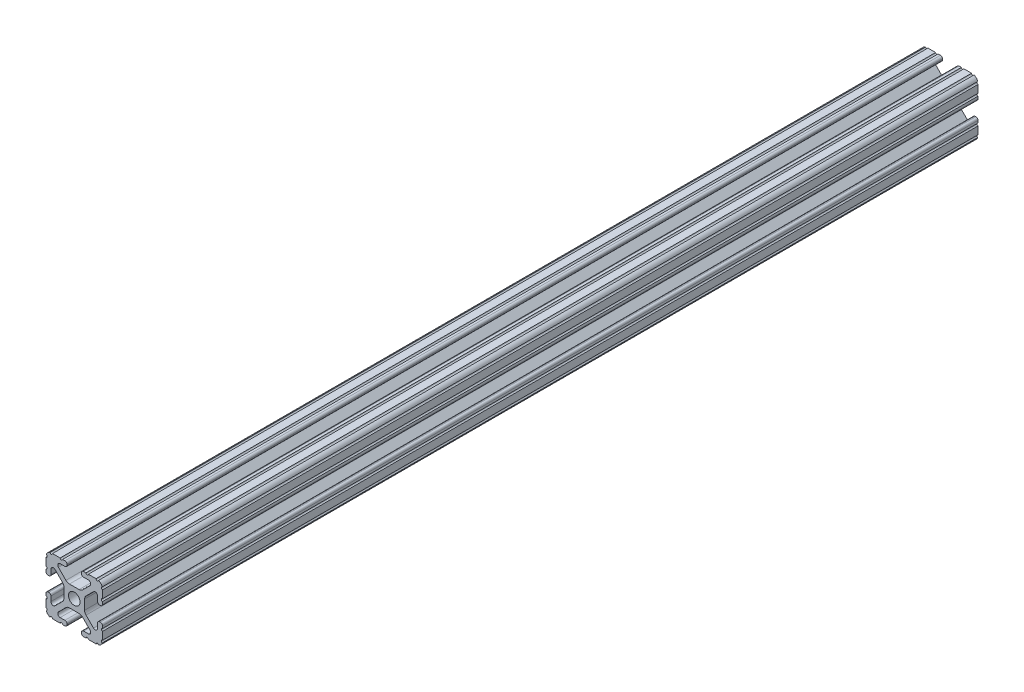
from build123d import *

# Parameters (mm, degrees)
BOSS_EXTRUDE1_START     = -196.819845
BOSS_EXTRUDE1_DEPTH     = 393.63969
CUT_EXTRUDE1_DEPTH      = 198.637626442
CUT_EXTRUDE1_DEPTH_BACK = 198.637626442
SKETCH5_R               = 0.55245


with BuildPart() as part:
    # Sketch4 → Boss-Extrude1 (new body)
    with BuildSketch(Plane.XY.offset(BOSS_EXTRUDE1_START)):
        with BuildLine():
            Line((4.190365, -12.7), (10.11729625, -12.7))
            ThreePointArc((10.11729625, -12.7), (11.943543585, -11.943543585), (12.7, -10.11729625))
            Line((12.7, -10.11729625), (12.7, -4.190365))
            ThreePointArc((12.7, -4.190365), (12.42492494, -3.52627506), (11.760835, -3.2512))
            Line((11.760835, -3.2512), (11.429365, -3.2512))
            ThreePointArc((11.429365, -3.2512), (10.76527506, -3.52627506), (10.4902, -4.190365))
            Line((10.4902, -4.190365), (10.4902, -6.348478019))
            ThreePointArc((10.4902, -6.348478019), (9.830707141, -7.335478831), (8.666460301, -7.103895736))
            Line((8.666460301, -7.103895736), (5.299899128, -3.737334563))
            ThreePointArc((5.299899128, -3.737334563), (4.817571085, -3.015479634), (4.6482, -2.16399369))
            Line((4.6482, -2.16399369), (4.6482, 0))
            Line((4.6482, 0), (2.6035, 0))
            ThreePointArc((2.6035, 0), (1.840952505, -1.840952505), (0, -2.6035))
            Line((0, -2.6035), (0, -4.6482))
            Line((0, -4.6482), (2.16399369, -4.6482))
            ThreePointArc((2.16399369, -4.6482), (3.015479634, -4.817571085), (3.737334563, -5.299899128))
            Line((3.737334563, -5.299899128), (7.103895736, -8.666460301))
            ThreePointArc((7.103895736, -8.666460301), (7.335478831, -9.830707141), (6.348478019, -10.4902))
            Line((6.348478019, -10.4902), (4.190365, -10.4902))
            ThreePointArc((4.190365, -10.4902), (3.52627506, -10.76527506), (3.2512, -11.429365))
            Line((3.2512, -11.429365), (3.2512, -11.760835))
            ThreePointArc((3.2512, -11.760835), (3.52627506, -12.42492494), (4.190365, -12.7))
        make_face()
    extrude(amount=BOSS_EXTRUDE1_DEPTH)

    # Sketch5 → Cut-Extrude1 (cut, two sides: drawn at the far end of the back side and taken through both)
    with BuildSketch(Plane.XY.offset(-CUT_EXTRUDE1_DEPTH_BACK)):
        with Locations((10.356153152, -12.7)):
            Circle(SKETCH5_R)
        with Locations((5.796028019, -12.7)):
            Circle(SKETCH5_R)
        with Locations((12.7, -10.356153152)):
            Circle(SKETCH5_R)
        with Locations((12.7, -5.796028019)):
            Circle(SKETCH5_R)
    extrude(amount=CUT_EXTRUDE1_DEPTH + CUT_EXTRUDE1_DEPTH_BACK, mode=Mode.SUBTRACT)

    # Mirror1: part across plane


with BuildPart() as part_1:
    add(part.part)
    add(part.part.mirror(Plane(origin=(0, 0, 0), x_dir=(0, 0, 1), z_dir=(1, 0, 0))))

    # Mirror2: part across plane


with BuildPart() as part_2:
    add(part_1.part)
    add(part_1.part.mirror(Plane.ZX))


solid = part_2.part
